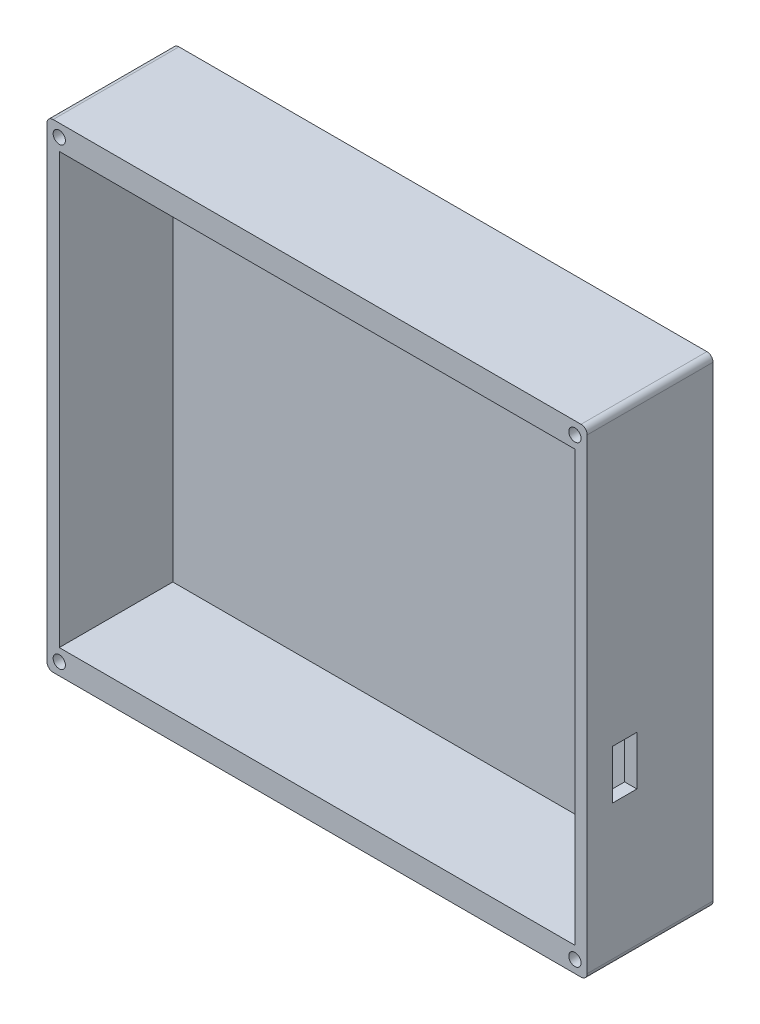
from build123d import *

# Parameters (mm, degrees)
SKETCH2_W           = 88
SKETCH2_H           = 78
BOSS_EXTRUDE1_DEPTH = 20.5
SKETCH5_W           = 84
SKETCH5_H           = 70
CUT_EXTRUDE1_DEPTH  = 18.5
SKETCH6_W           = 4
SKETCH6_H           = 8
CUT_EXTRUDE2_DEPTH  = 18.5
SKETCH7_R           = 1
CUT_EXTRUDE3_DEPTH  = 10
FILLET2_R           = 1


with BuildPart() as part:
    # Sketch2 → Boss-Extrude1 (new body)
    with BuildSketch(Plane.XY):
        Rectangle(SKETCH2_W, SKETCH2_H)
    extrude(amount=BOSS_EXTRUDE1_DEPTH)

    # Sketch5 → Cut-Extrude1 (cut)
    with BuildSketch(Plane.XY.offset(20.5)):
        Rectangle(SKETCH5_W, SKETCH5_H)
    extrude(amount=-CUT_EXTRUDE1_DEPTH, mode=Mode.SUBTRACT)

    # Sketch6 → Cut-Extrude2 (cut)
    with BuildSketch(Plane(origin=(44, 0, 0), x_dir=(0, 0, -1), z_dir=(1, 0, 0))):
        with Locations((-14.4, -12)):
            Rectangle(SKETCH6_W, SKETCH6_H)
    extrude(amount=-CUT_EXTRUDE2_DEPTH, mode=Mode.SUBTRACT)

    # Sketch7 → Cut-Extrude3 (cut)
    with BuildSketch(Plane.XY.offset(20.5)):
        with Locations((-42, 37)):
            Circle(SKETCH7_R)
        with Locations((-42, -37)):
            Circle(SKETCH7_R)
        with Locations((42, -37)):
            Circle(SKETCH7_R)
        with Locations((42, 37)):
            Circle(SKETCH7_R)
    extrude(amount=-CUT_EXTRUDE3_DEPTH, mode=Mode.SUBTRACT)

    # Fillet2
    fillet2_edges = [part.edges().sort_by_distance(p)[0] for p in [
        (44, -39, 10.25),
        (-44, -39, 10.25),
        (-44, 39, 10.25),
        (44, 39, 10.25),
    ]]
    fillet(fillet2_edges, radius=FILLET2_R)


solid = part.part
